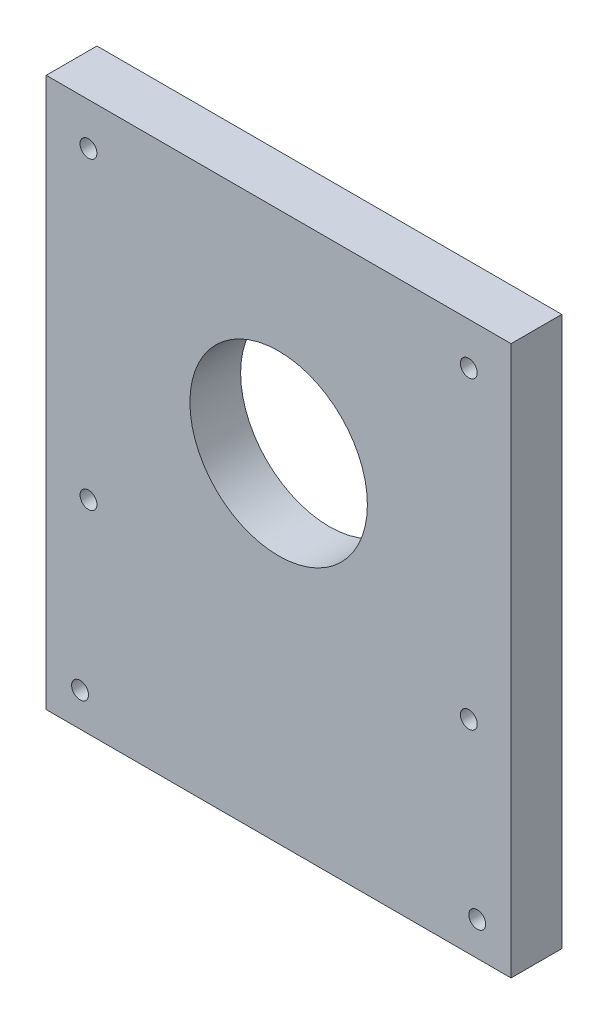
from build123d import *

# Parameters (mm, degrees)
SKETCH1_W               = 110
SKETCH1_H               = 130
BOSS_EXTRUDE1_DEPTH     = 12
CUT_EXTRUDE1_DEPTH      = 86.988371307
CUT_EXTRUDE1_DEPTH_BACK = 86.988371307
SKETCH2_R               = 2
SKETCH3_R               = 21
CUT_EXTRUDE2_DEPTH      = 86.988371307


with BuildPart() as part:
    # Sketch1 → Boss-Extrude1 (new body)
    with BuildSketch(Plane.XY):
        Rectangle(SKETCH1_W, SKETCH1_H)
    extrude(amount=BOSS_EXTRUDE1_DEPTH)

    # Sketch2 → Cut-Extrude1 (cut, two sides: drawn at the far end of the back side and taken through both)
    with BuildSketch(Plane(origin=(0, 0, 0), x_dir=(-1, 0, 0), z_dir=(0, 0, -1)).offset(-CUT_EXTRUDE1_DEPTH_BACK)):
        with Locations((-45, 55)):
            Circle(SKETCH2_R)
        with Locations((-45, -17)):
            Circle(SKETCH2_R)
        with Locations((-47, -57)):
            Circle(SKETCH2_R)
        with Locations((47, -57)):
            Circle(SKETCH2_R)
        with Locations((45, -17)):
            Circle(SKETCH2_R)
        with Locations((45, 55)):
            Circle(SKETCH2_R)
    extrude(amount=CUT_EXTRUDE1_DEPTH + CUT_EXTRUDE1_DEPTH_BACK, mode=Mode.SUBTRACT)

    # Sketch3 → Cut-Extrude2 (cut, through all)
    with BuildSketch(Plane.XY.offset(12)):
        with Locations((0, 15)):
            Circle(SKETCH3_R)
    extrude(amount=-CUT_EXTRUDE2_DEPTH, mode=Mode.SUBTRACT)


solid = part.part
